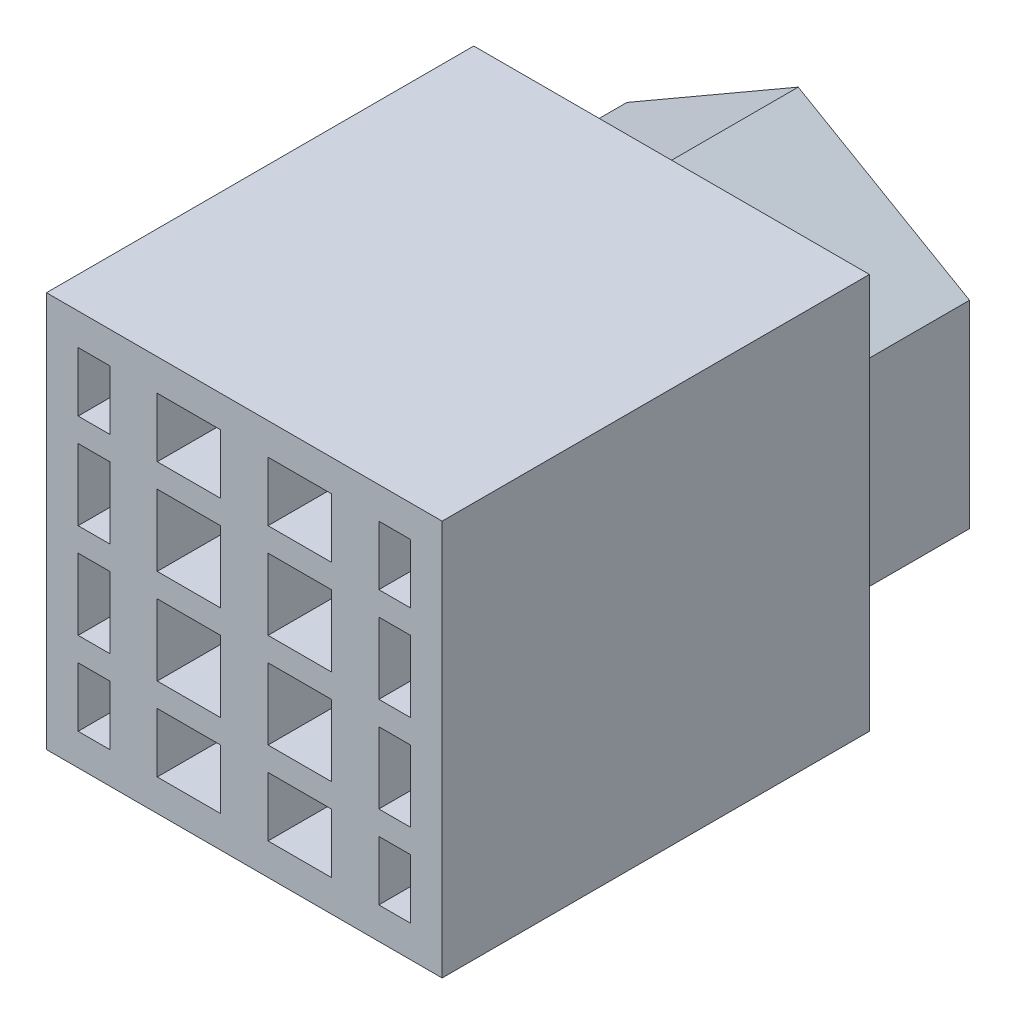
from build123d import *

# Parameters (mm, degrees)
SKETCH_8_W       = 25
SKETCH_8_H       = 25
SKETCH_8_W_2     = 4
SKETCH_8_H_2     = 21
SKETCH_8_W_3     = 2
EXTRUDE_7_DEPTH  = 25
SKETCH_9_W       = 25
SKETCH_9_H       = 25
EXTRUDE_8_DEPTH  = 2
SKETCH_14_W      = 25
SKETCH_14_H      = 1.5
EXTRUDE_11_DEPTH = 25
EXTRUDE_14_DEPTH = 6
EXTRUDE_16_DEPTH = 2


with BuildPart() as part:
    # 草图8 → 凸台-拉伸7 (new body)
    with BuildSketch(Plane.XY):
        Rectangle(SKETCH_8_W, SKETCH_8_H)
        with Locations((3.5, 0)):
            Rectangle(SKETCH_8_W_2, SKETCH_8_H_2, mode=Mode.SUBTRACT)
        with Locations((-3.5, 0)):
            Rectangle(SKETCH_8_W_2, SKETCH_8_H_2, mode=Mode.SUBTRACT)
        with Locations((-9.5, 0)):
            Rectangle(SKETCH_8_W_3, SKETCH_8_H_2, mode=Mode.SUBTRACT)
        with Locations((9.5, 0)):
            Rectangle(SKETCH_8_W_3, SKETCH_8_H_2, mode=Mode.SUBTRACT)
    extrude(amount=EXTRUDE_7_DEPTH)

    # 草图9 → 凸台-拉伸8 (add)
    with BuildSketch(Plane(origin=(0, 0, 0), x_dir=(-1, 0, 0), z_dir=(0, 0, -1))):
        Rectangle(SKETCH_9_W, SKETCH_9_H)
    extrude(amount=EXTRUDE_8_DEPTH)

    # 草图14 → 凸台-拉伸11 (add)
    with BuildSketch(Plane.XY.offset(25)):
        Rectangle(SKETCH_14_W, SKETCH_14_H)
        with Locations((0, 6)):
            Rectangle(SKETCH_14_W, SKETCH_14_H)
        with Locations((0, -6)):
            Rectangle(SKETCH_14_W, SKETCH_14_H)
    extrude(amount=-EXTRUDE_11_DEPTH)

    # 草图16 → 凸台-拉伸14 (add)
    with BuildSketch(Plane(origin=(0, 0, -2), x_dir=(-1, 0, 0), z_dir=(0, 0, -1))):
        Polygon((0, -12.5), (10.825317547, -6.25), (10.825317547, 6.25), (0, 12.5), (-10.825317547, 6.25), (-10.825317547, -6.25), align=None)
        Polygon((0, -10.190598923), (8.825317547, -5.095299462), (8.825317547, 5.095299462), (0, 10.190598923), (-8.825317547, 5.095299462), (-8.825317547, -5.095299462), align=None, mode=Mode.SUBTRACT)
    extrude(amount=EXTRUDE_14_DEPTH)

    # 草图18 → 凸台-拉伸16 (add)
    with BuildSketch(Plane(origin=(0, 0, -8), x_dir=(-1, 0, 0), z_dir=(0, 0, -1))):
        Polygon((0, 12.5), (-10.825317547, 6.25), (-10.825317547, -6.25), (0, -12.5), (10.825317547, -6.25), (10.825317547, 6.25), align=None)
    extrude(amount=EXTRUDE_16_DEPTH)


solid = part.part
